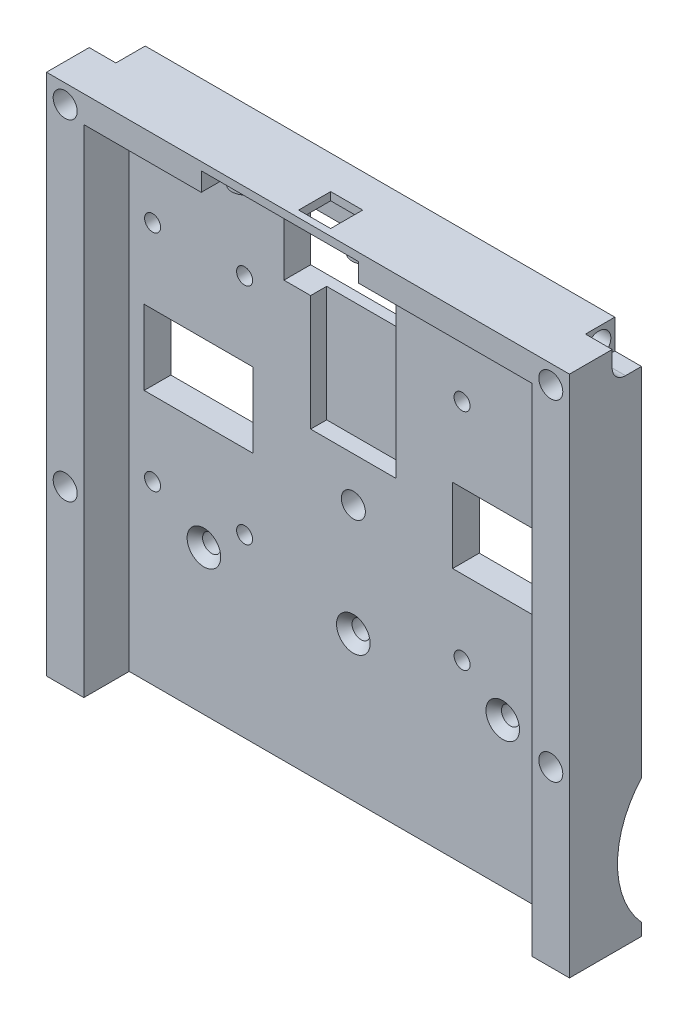
from build123d import *

# Parameters (mm, degrees)
SKETCH1_W                                       = 98
SKETCH1_H                                       = 80
BOSS_EXTRUDE1_DEPTH                             = 5
SKETCH2_W                                       = 7
SKETCH2_H                                       = 80
BOSS_EXTRUDE2_DEPTH                             = 8.5
SKETCH3_W                                       = 7
SKETCH3_H                                       = 80
BOSS_EXTRUDE3_DEPTH                             = 8.5
SKETCH8_W                                       = 84
SKETCH8_H                                       = 8.5
BOSS_EXTRUDE5_DEPTH                             = 5
SKETCH13_R                                      = 2.25
CUT_EXTRUDE7_DEPTH                              = 3.25
SKETCH15_R                                      = 1.5
CUT_EXTRUDE9_DEPTH                              = 3.25
SKETCH14_W                                      = 16
SKETCH14_H                                      = 16
CUT_EXTRUDE13_DEPTH                             = 3
SKETCH18_W                                      = 16
SKETCH18_H                                      = 12
CUT_EXTRUDE14_DEPTH                             = 64.822018144
SKETCH19_W                                      = 16
SKETCH19_H                                      = 5.672791846
CUT_EXTRUDE15_DEPTH                             = 3
SKETCH20_R                                      = 2.25
CUT_EXTRUDE20_DEPTH                             = 3.25
BOSS_EXTRUDE7_DEPTH                             = 10
BOSS_EXTRUDE9_DEPTH                             = 8
CSK_FOR_M3_FLAT_HEAD_MACHINE_SCREW1_D           = 3.4
CSK_FOR_M3_FLAT_HEAD_MACHINE_SCREW1_CSINK_D     = 6.3
CSK_FOR_M3_FLAT_HEAD_MACHINE_SCREW1_CSINK_ANGLE = 90
SKETCH51_R                                      = 17.5
CUT_EXTRUDE23_DEPTH                             = 8
CUT_EXTRUDE24_START                             = -8
SKETCH52_R                                      = 17.5
CUT_EXTRUDE24_DEPTH                             = 8
SKETCH42_R                                      = 2.25
CUT_EXTRUDE25_DEPTH                             = 4.25
SKETCH53_R                                      = 2.25
CUT_EXTRUDE26_DEPTH                             = 8.25
SKETCH54_R                                      = 2.25
CUT_EXTRUDE27_DEPTH                             = 13.25
CUT_EXTRUDE28_DEPTH                             = 5
CUT_EXTRUDE29_START                             = -13.25
SKETCH56_R                                      = 2.25
CUT_EXTRUDE29_DEPTH                             = 13.25
CUT_EXTRUDE30_START                             = -5
CUT_EXTRUDE30_DEPTH                             = 5
SKETCH65_W                                      = 20.4
SKETCH65_H                                      = 14
CUT_EXTRUDE31_DEPTH                             = 77.401897882
SKETCH69_W                                      = 6
SKETCH69_H                                      = 6
CUT_EXTRUDE33_DEPTH                             = 13.5
SKETCH75_W                                      = 28.5
SKETCH75_H                                      = 7
CUT_EXTRUDE39_DEPTH                             = 11
SKETCH77_R                                      = 2.5
BOSS_EXTRUDE11_DEPTH                            = 2.5
SKETCH79_R                                      = 1.5
CUT_EXTRUDE41_DEPTH                             = 3.2
SKETCH80_W                                      = 5
SKETCH80_H                                      = 12
CUT_EXTRUDE42_DEPTH                             = 77.401897882
SKETCH82_W                                      = 0.8
SKETCH82_H                                      = 7
SKETCH82_W_2                                    = 0.2
CUT_EXTRUDE43_DEPTH                             = 11


with BuildPart() as part:
    # Sketch1 → Boss-Extrude1 (new body)
    with BuildSketch(Plane.XY):
        Rectangle(SKETCH1_W, SKETCH1_H)
    extrude(amount=BOSS_EXTRUDE1_DEPTH)

    # Sketch2 → Boss-Extrude2 (add)
    with BuildSketch(Plane.XY.offset(5)):
        with Locations((-45.5, 0)):
            Rectangle(SKETCH2_W, SKETCH2_H)
    extrude(amount=BOSS_EXTRUDE2_DEPTH)

    # Sketch3 → Boss-Extrude3 (add)
    with BuildSketch(Plane.XY.offset(5)):
        with Locations((45.5, 0)):
            Rectangle(SKETCH3_W, SKETCH3_H)
    extrude(amount=BOSS_EXTRUDE3_DEPTH)

    # Sketch8 → Boss-Extrude5 (add)
    with BuildSketch(Plane(origin=(0, 40, 0), x_dir=(1, 0, 0), z_dir=(0, 1, 0))):
        with Locations((0, -9.25)):
            Rectangle(SKETCH8_W, SKETCH8_H)
    extrude(amount=-BOSS_EXTRUDE5_DEPTH)

    # Sketch13 → Cut-Extrude7 (cut)
    with BuildSketch(Plane.XY.offset(5)):
        with Locations((0, -10)):
            Circle(SKETCH13_R)
    extrude(amount=-CUT_EXTRUDE7_DEPTH, mode=Mode.SUBTRACT)

    # Sketch15 → Cut-Extrude9 (cut)
    with BuildSketch(Plane.XY.offset(5)):
        with Locations((-37.62, 17)):
            Circle(SKETCH15_R)
        with Locations((-20.38, 17)):
            Circle(SKETCH15_R)
        with Locations((-37.62, -25)):
            Circle(SKETCH15_R)
        with Locations((-20.38, -25)):
            Circle(SKETCH15_R)
        with Locations((20.38, -25)):
            Circle(SKETCH15_R)
        with Locations((37.62, -25)):
            Circle(SKETCH15_R)
        with Locations((37.62, 17)):
            Circle(SKETCH15_R)
        with Locations((20.38, 17)):
            Circle(SKETCH15_R)
    extrude(amount=-CUT_EXTRUDE9_DEPTH, mode=Mode.SUBTRACT)

    # Sketch14 → Cut-Extrude13 (cut)
    with BuildSketch(Plane.XY.offset(5)):
        with Locations((0, 6.327208154)):
            Rectangle(SKETCH14_W, SKETCH14_H)
    extrude(amount=-CUT_EXTRUDE13_DEPTH, mode=Mode.SUBTRACT)

    # Sketch18 → Cut-Extrude14 (cut, through all)
    with BuildSketch(Plane.XY.offset(5)):
        with Locations((0, 26)):
            Rectangle(SKETCH18_W, SKETCH18_H)
    extrude(amount=-CUT_EXTRUDE14_DEPTH, mode=Mode.SUBTRACT)

    # Sketch19 → Cut-Extrude15 (cut)
    with BuildSketch(Plane.XY.offset(5)):
        with Locations((0, 17.163604077)):
            Rectangle(SKETCH19_W, SKETCH19_H)
    extrude(amount=-CUT_EXTRUDE15_DEPTH, mode=Mode.SUBTRACT)

    # Sketch20 → Cut-Extrude20 (cut)
    with BuildSketch(Plane(origin=(0, 0, 0), x_dir=(-1, 0, 0), z_dir=(0, 0, -1))):
        with Locations((18.25, 21.5)):
            Circle(SKETCH20_R)
        with Locations((-18.25, 21.5)):
            Circle(SKETCH20_R)
        with Locations((18.25, -15)):
            Circle(SKETCH20_R)
        with Locations((-18.25, -15)):
            Circle(SKETCH20_R)
    extrude(amount=-CUT_EXTRUDE20_DEPTH, mode=Mode.SUBTRACT)

    # Sketch26 → Boss-Extrude7 (add)
    with BuildSketch(Plane(origin=(0, -40, 0), x_dir=(-1, 0, 0), z_dir=(0, -1, 0))):
        Polygon((49, -13.5), (42, -13.5), (42, -5), (-42, -5), (-42, -13.5), (-49, -13.5), (-49, 0), (49, 0), align=None)
    extrude(amount=BOSS_EXTRUDE7_DEPTH)

    # Sketch47 → Boss-Extrude9 (add)
    with BuildSketch(Plane(origin=(0, -50, 0), x_dir=(-1, 0, 0), z_dir=(0, -1, 0))):
        Polygon((49, -13.5), (42, -13.5), (42, -5), (-42, -5), (-42, -13.5), (-49, -13.5), (-49, 0), (49, 0), align=None)
    extrude(amount=BOSS_EXTRUDE9_DEPTH)

    # CSK for M3 Flat Head Machine Screw1 (through all)
    with Locations(Plane.XY.offset(5)):
        with Locations((28, -30.88), (0, -30.88), (-28, -30.88)):
            CounterSinkHole(CSK_FOR_M3_FLAT_HEAD_MACHINE_SCREW1_D / 2, CSK_FOR_M3_FLAT_HEAD_MACHINE_SCREW1_CSINK_D / 2, counter_sink_angle=CSK_FOR_M3_FLAT_HEAD_MACHINE_SCREW1_CSINK_ANGLE)

    # Sketch51 → Cut-Extrude23 (cut)
    with BuildSketch(Plane.ZY.offset(49)):
        with Locations((-13, -44)):
            Circle(SKETCH51_R)
    extrude(amount=-CUT_EXTRUDE23_DEPTH, mode=Mode.SUBTRACT)

    # Sketch52 → Cut-Extrude24 (cut)
    with BuildSketch(Plane(origin=(49, 0, 0), x_dir=(0, 0, -1), z_dir=(1, 0, 0)).offset(CUT_EXTRUDE24_START)):
        with Locations((13, -44)):
            Circle(SKETCH52_R)
    extrude(amount=CUT_EXTRUDE24_DEPTH, mode=Mode.SUBTRACT)

    # Sketch42 → Cut-Extrude25 (cut)
    with BuildSketch(Plane.XY.offset(13.5)):
        with Locations((-45.5, 36.5)):
            Circle(SKETCH42_R)
        with Locations((45.5, 36.5)):
            Circle(SKETCH42_R)
    extrude(amount=-CUT_EXTRUDE25_DEPTH, mode=Mode.SUBTRACT)

    # Sketch53 → Cut-Extrude26 (cut)
    with BuildSketch(Plane.XY.offset(13.5)):
        with Locations((-45.5, -25.5)):
            Circle(SKETCH53_R)
        with Locations((45.5, -25.5)):
            Circle(SKETCH53_R)
    extrude(amount=-CUT_EXTRUDE26_DEPTH, mode=Mode.SUBTRACT)

    # Sketch54 → Cut-Extrude27 (cut)
    with BuildSketch(Plane.ZY.offset(49)):
        with Locations((3, 37)):
            Circle(SKETCH54_R)
    extrude(amount=-CUT_EXTRUDE27_DEPTH, mode=Mode.SUBTRACT)

    # Sketch55 → Cut-Extrude28 (cut)
    with BuildSketch(Plane.ZY.offset(49)):
        with BuildLine():
            Line((5.5, 37), (5.5, 40))
            Line((5.5, 40), (0, 40))
            Line((0, 40), (0, 34.5))
            Line((0, 34.5), (3, 34.5))
            ThreePointArc((3, 34.5), (4.767766953, 35.232233047), (5.5, 37))
        make_face()
    extrude(amount=-CUT_EXTRUDE28_DEPTH, mode=Mode.SUBTRACT)

    # Sketch56 → Cut-Extrude29 (cut)
    with BuildSketch(Plane(origin=(49, 0, 0), x_dir=(0, 0, -1), z_dir=(1, 0, 0)).offset(CUT_EXTRUDE29_START)):
        with Locations(Location((-3, 37, 0), (0, 0, 180))):
            Circle(SKETCH56_R)
    extrude(amount=CUT_EXTRUDE29_DEPTH, mode=Mode.SUBTRACT)

    # Sketch57 → Cut-Extrude30 (cut)
    with BuildSketch(Plane(origin=(49, 0, 0), x_dir=(0, 0, -1), z_dir=(1, 0, 0)).offset(CUT_EXTRUDE30_START)):
        with BuildLine():
            Line((-5.5, 37), (-5.5, 40))
            Line((-5.5, 40), (0, 40))
            Line((0, 40), (0, 34.5))
            Line((0, 34.5), (-3, 34.5))
            ThreePointArc((-3, 34.5), (-4.767766953, 35.232233047), (-5.5, 37))
        make_face()
    extrude(amount=CUT_EXTRUDE30_DEPTH, mode=Mode.SUBTRACT)

    # Sketch65 → Cut-Extrude31 (cut, through all)
    with BuildSketch(Plane.XY.offset(5)):
        with Locations((-29, -4)):
            Rectangle(SKETCH65_W, SKETCH65_H)
        with Locations((28.8, -4)):
            Rectangle(SKETCH65_W, SKETCH65_H)
    extrude(amount=-CUT_EXTRUDE31_DEPTH, mode=Mode.SUBTRACT)

    # Sketch69 → Cut-Extrude33 (cut)
    with BuildSketch(Plane.XZ.offset(-35)):
        with Locations((0, 9.25)):
            Rectangle(SKETCH69_W, SKETCH69_H)
    extrude(amount=-CUT_EXTRUDE33_DEPTH, mode=Mode.SUBTRACT)

    # Sketch75 → Cut-Extrude39 (cut)
    with BuildSketch(Plane.XY.offset(13.5)):
        with Locations((-4.95, 35)):
            Rectangle(SKETCH75_W, SKETCH75_H)
    extrude(amount=-CUT_EXTRUDE39_DEPTH, mode=Mode.SUBTRACT)

    # Sketch77 → Boss-Extrude11 (add)
    with BuildSketch(Plane.XZ.offset(-38.5)):
        with Locations(Location((6.3, 9.05, 0), (0, 0, 90))):
            Circle(SKETCH77_R)
        with Locations(Location((-16.2, 9.05, 0), (0, 0, 90))):
            Circle(SKETCH77_R)
    extrude(amount=BOSS_EXTRUDE11_DEPTH)

    # Sketch79 → Cut-Extrude41 (cut)
    with BuildSketch(Plane.XZ.offset(-36)):
        with Locations(Location((6.3, 9.05, 0), (0, 0, 270))):
            Circle(SKETCH79_R)
        with Locations(Location((-16.2, 9.05, 0), (0, 0, 270))):
            Circle(SKETCH79_R)
    extrude(amount=-CUT_EXTRUDE41_DEPTH, mode=Mode.SUBTRACT)

    # Sketch80 → Cut-Extrude42 (cut, through all)
    with BuildSketch(Plane.XY.offset(5)):
        with Locations((-10.5, 26)):
            Rectangle(SKETCH80_W, SKETCH80_H)
    extrude(amount=-CUT_EXTRUDE42_DEPTH, mode=Mode.SUBTRACT)

    # Sketch82 → Cut-Extrude43 (cut)
    with BuildSketch(Plane.XY.offset(13.5)):
        with Locations((-19.6, 35)):
            Rectangle(SKETCH82_W, SKETCH82_H)
        with Locations((9.4, 35)):
            Rectangle(SKETCH82_W_2, SKETCH82_H)
    extrude(amount=-CUT_EXTRUDE43_DEPTH, mode=Mode.SUBTRACT)


solid = part.part
